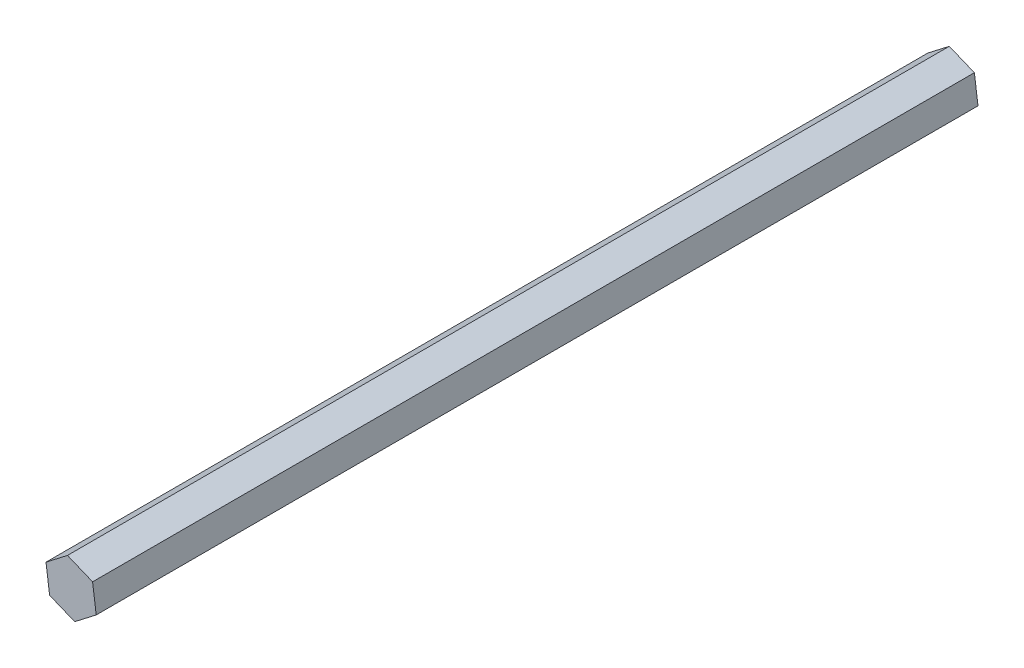
from build123d import *

# Parameters (mm, degrees)
BOSS_EXTRUDE1_DEPTH = 254
SKETCH2_W           = 24.031674189
SKETCH2_H           = 20.528411612
CUT_EXTRUDE1_DEPTH  = 15.748


with BuildPart() as part:
    # Sketch1 → Boss-Extrude1 (new body)
    with BuildSketch(Plane.XY):
        Polygon((5.804216038, 4.480447468), (-0.978073309, 7.266822272), (-6.782289347, 2.786374804), (-5.804216038, -4.480447468), (0.978073309, -7.266822272), (6.782289347, -2.786374804), align=None)
    extrude(amount=BOSS_EXTRUDE1_DEPTH)

    # Sketch2 → Cut-Extrude1 (cut)
    with BuildSketch(Plane(origin=(0, 0, 0), x_dir=(-1, 0, 0), z_dir=(0, 0, -1))):
        with Locations((-1.796012448, -2.997383534)):
            Rectangle(SKETCH2_W, SKETCH2_H)
    extrude(amount=-CUT_EXTRUDE1_DEPTH, mode=Mode.SUBTRACT)


solid = part.part
